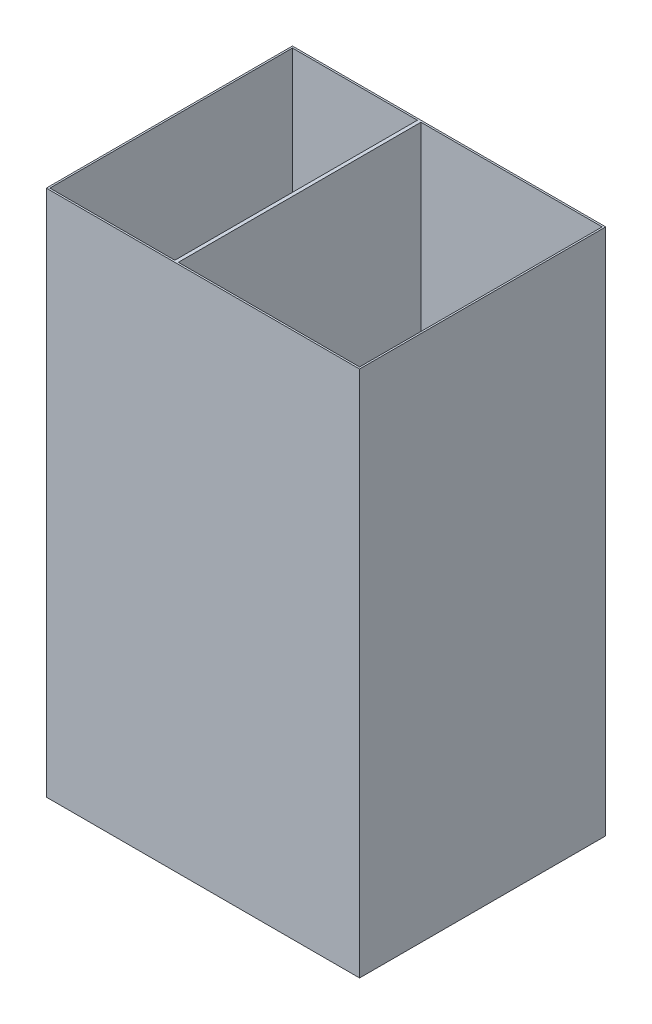
from build123d import *

# Parameters (mm, degrees)
ESBO_O1_W                = 89.1
ESBO_O1_H                = 70
ESBO_O1_W_2              = 51.55
ESBO_O1_H_2              = 69
ESBO_O1_W_3              = 35.55
RESSALTO_EXTRUS_O1_DEPTH = 150
ESBO_O3_R                = 2
ESBO_O3_R_2              = 4.5
CORTE_EXTRUS_O1_DEPTH    = 1


with BuildPart() as part:
    # Esboço1 → Ressalto-extrusão1 (new body)
    with BuildSketch(Plane(origin=(0, 0, 0), x_dir=(1, 0, 0), z_dir=(0, 1, 0))):
        Rectangle(ESBO_O1_W, ESBO_O1_H)
        with Locations((18.275, 0)):
            Rectangle(ESBO_O1_W_2, ESBO_O1_H_2, mode=Mode.SUBTRACT)
        with Locations((-26.275, 0)):
            Rectangle(ESBO_O1_W_3, ESBO_O1_H_2, mode=Mode.SUBTRACT)
    extrude(amount=RESSALTO_EXTRUS_O1_DEPTH)

    # Esboço3 → Corte-extrusão1 (cut)
    with BuildSketch(Plane(origin=(-7.5, 0, 0), x_dir=(0, 0, -1), z_dir=(1, 0, 0))):
        with Locations((17.5, 75.034551114)):
            Circle(ESBO_O3_R)
        with Locations((-17.5, 75.034551114)):
            Circle(ESBO_O3_R)
        with Locations((0, 83.034551114)):
            Circle(ESBO_O3_R_2)
    extrude(amount=-CORTE_EXTRUS_O1_DEPTH, mode=Mode.SUBTRACT)


solid = part.part
